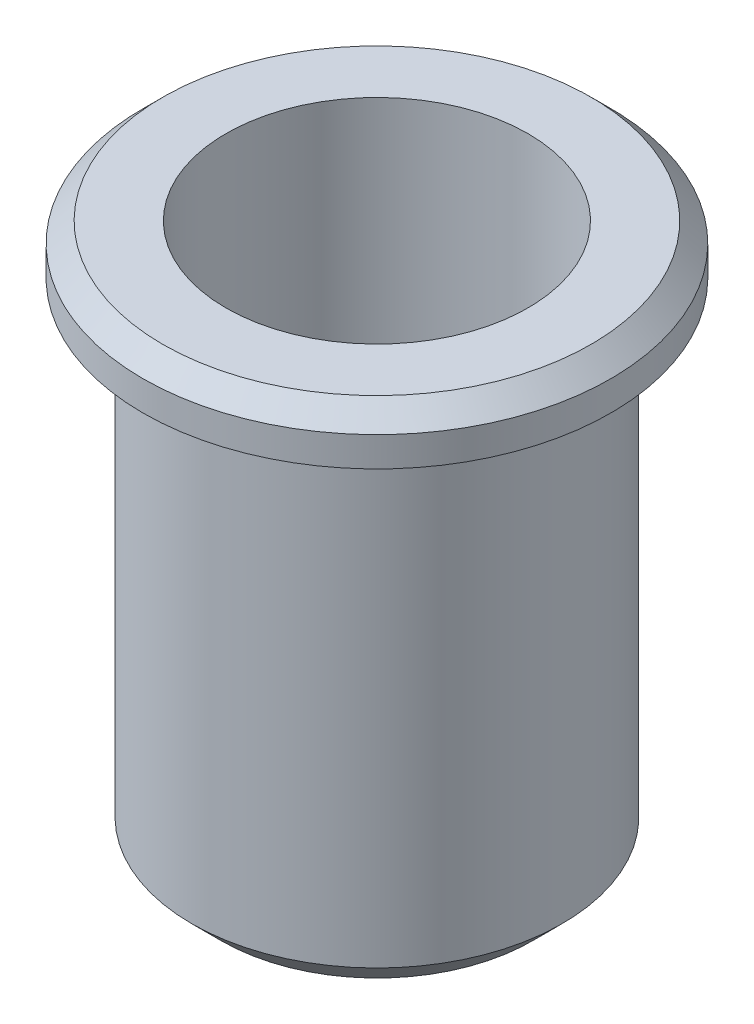
from build123d import *


with BuildPart() as part:
    # Sketch1 → Revolve1 (revolve)
    with BuildSketch(Plane.XY, mode=Mode.PRIVATE) as revolve1_sk:
        Polygon((1.9939, 0), (3.988, 0), (4.75, 0.762), (4.75, 12.73), (6, 12.73), (6, 13.492), (5.492, 14), (3.8735, 14), (3.8735, 2.365234385), (1.9939, 2.365234385), align=None)
    revolve(revolve1_sk.sketch.rotate(Axis((0, 25.147912088, 0), (0, -1, 0)), 90), axis=Axis((0, 25.147912088, 0), (0, -1, 0)))


solid = part.part
